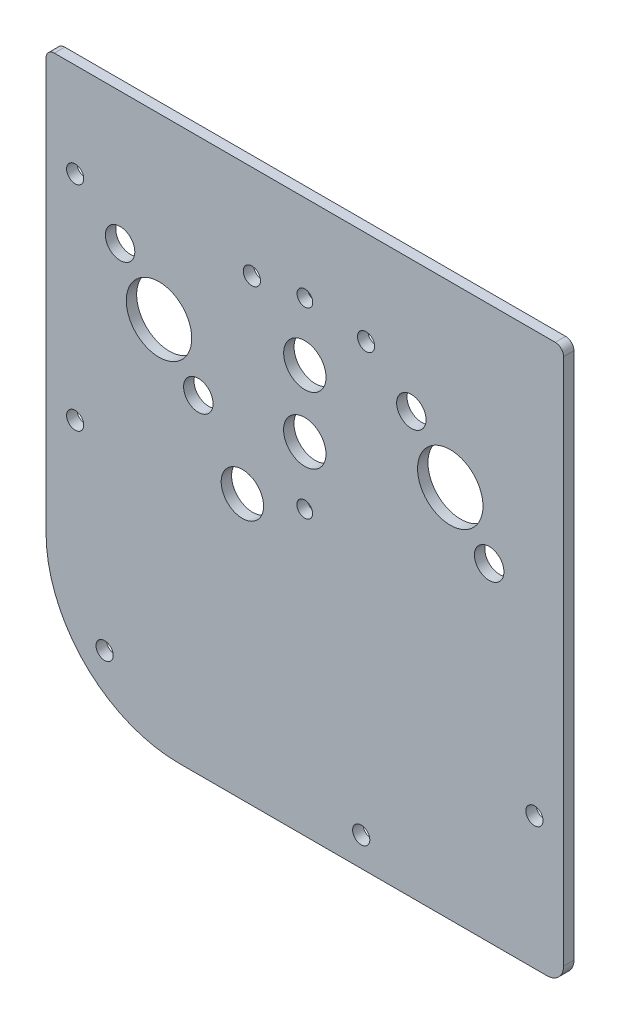
from build123d import *

# Parameters (mm, degrees)
SKETCH2_R           = 2.625
SKETCH2_R_2         = 6.477
SKETCH2_R_3         = 2.4
SKETCH2_R_4         = 10
SKETCH2_R_5         = 4.5000037
BOSS_EXTRUDE1_DEPTH = 3.175
BOSS_EXTRUDE2_START = -3.175
BOSS_EXTRUDE2_DEPTH = 3.175
FILLET1_R           = 2.54


with BuildPart() as part:
    # Sketch2 → Boss-Extrude1 (new body)
    with BuildSketch(Plane.XY):
        with BuildLine():
            Line((-16.662660117, 125.372318995), (128.780651825, 125.372318995))
            ThreePointArc((128.780651825, 125.372318995), (133.270779886, 123.512447055), (135.130651825, 119.022318995))
            Line((135.130651825, 119.022318995), (135.130651825, -19.407679937))
            ThreePointArc((135.130651825, -19.407679937), (133.642754274, -22.999782385), (130.050651825, -24.487679937))
            Line((130.050651825, -24.487679937), (17.627339883, -24.487679937))
            ThreePointArc((17.627339883, -24.487679937), (-11.109479704, -12.584499524), (-23.012660117, 16.152320063))
            Line((-23.012660117, 16.152320063), (-23.012660117, 119.022318995))
            ThreePointArc((-23.012660117, 119.022318995), (-21.152788178, 123.512447055), (-16.662660117, 125.372318995))
        make_face()
        with Locations((-14.122660117, 115.657274828)):
            Circle(SKETCH2_R, mode=Mode.SUBTRACT)
        with Locations((56.050128961, 79.792333504)):
            Circle(SKETCH2_R_2, mode=Mode.SUBTRACT)
        with Locations((56.034611898, 62.012340275)):
            Circle(SKETCH2_R_3, mode=Mode.SUBTRACT)
        with Locations((56.067862747, 100.112325766)):
            Circle(SKETCH2_R_2, mode=Mode.SUBTRACT)
        with Locations((56.08337981, 117.892318995)):
            Circle(SKETCH2_R_3, mode=Mode.SUBTRACT)
        with Locations((36.9797887, 56.4940647)):
            Circle(SKETCH2_R_2, mode=Mode.SUBTRACT)
        with Locations((39.880571418, 115.657274828)):
            Circle(SKETCH2_R, mode=Mode.SUBTRACT)
        with Locations((74.777420291, 115.710615977)):
            Circle(SKETCH2_R, mode=Mode.SUBTRACT)
        with Locations((-14.122660117, 50.442319529)):
            Circle(SKETCH2_R, mode=Mode.SUBTRACT)
        with Locations((-5.124288877, -6.016277999)):
            Circle(SKETCH2_R, mode=Mode.SUBTRACT)
        with Locations((73.296411889, -15.597679937)):
            Circle(SKETCH2_R, mode=Mode.SUBTRACT)
        with Locations((126.240651825, 15.946756738)):
            Circle(SKETCH2_R, mode=Mode.SUBTRACT)
        with Locations((11.5011229, 89.92565906)):
            Circle(SKETCH2_R_4, mode=Mode.SUBTRACT)
        with Locations((100.509036058, 89.97900021)):
            Circle(SKETCH2_R_4, mode=Mode.SUBTRACT)
        with Locations((88.617464572, 104.15082325)):
            Circle(SKETCH2_R_5, mode=Mode.SUBTRACT)
        with Locations((112.400607544, 75.80717717)):
            Circle(SKETCH2_R_5, mode=Mode.SUBTRACT)
        with Locations((-0.390448587, 104.097482101)):
            Circle(SKETCH2_R_5, mode=Mode.SUBTRACT)
        with Locations((23.518543133, 75.859913549)):
            Circle(SKETCH2_R_5, mode=Mode.SUBTRACT)
    extrude(amount=BOSS_EXTRUDE1_DEPTH)

    # Sketch3 → Boss-Extrude2 (add)
    with BuildSketch(Plane.XY.offset(3.175).offset(BOSS_EXTRUDE2_START)):
        with BuildLine():
            Line((-23.012660117, 119.022318995), (-23.012660117, 144.422318995))
            Line((-23.012660117, 144.422318995), (135.130651825, 144.422318995))
            Line((135.130651825, 144.422318995), (135.130651825, 119.022318995))
            ThreePointArc((135.130651825, 119.022318995), (133.270779886, 123.512447055), (128.780651825, 125.372318995))
            Line((128.780651825, 125.372318995), (-16.662660117, 125.372318995))
            ThreePointArc((-16.662660117, 125.372318995), (-21.152788178, 123.512447055), (-23.012660117, 119.022318995))
        make_face()
    extrude(amount=BOSS_EXTRUDE2_DEPTH)

    # Fillet1
    fillet1_edges = [part.edges().sort_by_distance(p)[0] for p in [
        (-23.012660117, 144.422318995, 1.5875),
        (135.130651825, 144.422318995, 1.5875),
    ]]
    fillet(fillet1_edges, radius=FILLET1_R)


solid = part.part
